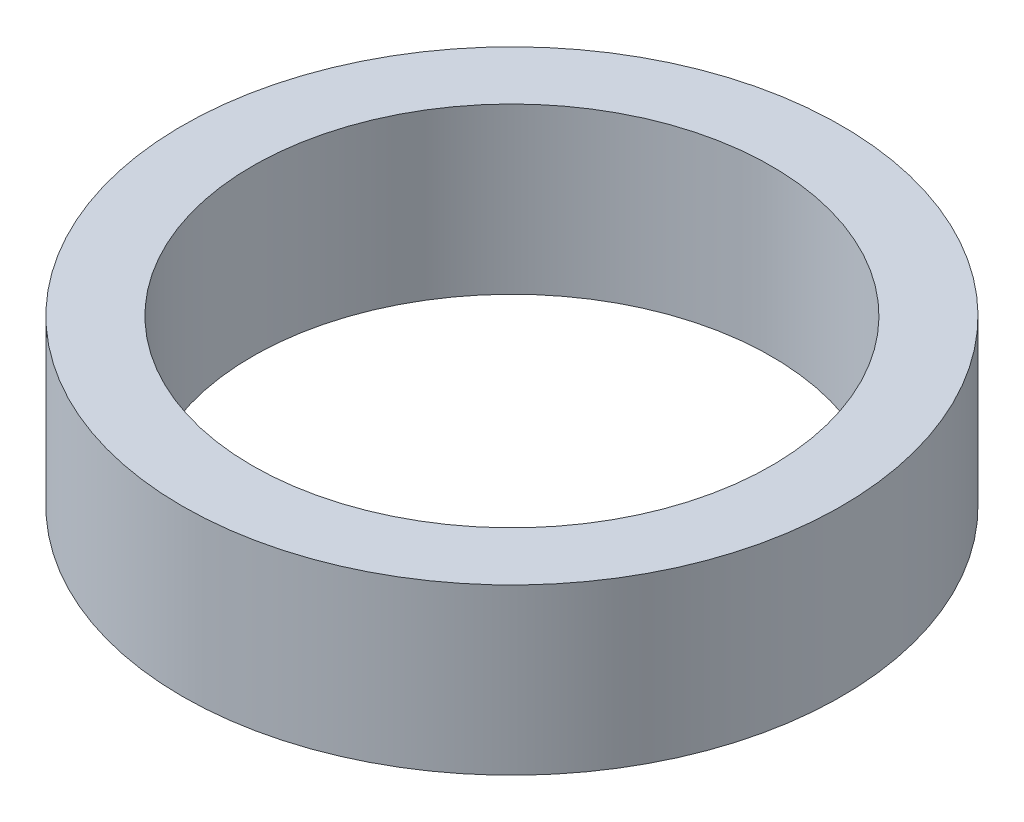
from build123d import *

# Parameters (mm, degrees)
SKETCH1_R           = 4
SKETCH1_R_2         = 3.15
BOSS_EXTRUDE1_DEPTH = 2


with BuildPart() as part:
    # Sketch1 → Boss-Extrude1 (new body)
    with BuildSketch(Plane(origin=(0, 0, 0), x_dir=(1, 0, 0), z_dir=(0, 1, 0))):
        with Locations(Location((0, 0, 0), (0, 0, 270))):
            Circle(SKETCH1_R)
        with Locations(Location((0, 0, 0), (0, 0, 270))):
            Circle(SKETCH1_R_2, mode=Mode.SUBTRACT)
    extrude(amount=BOSS_EXTRUDE1_DEPTH)


solid = part.part
